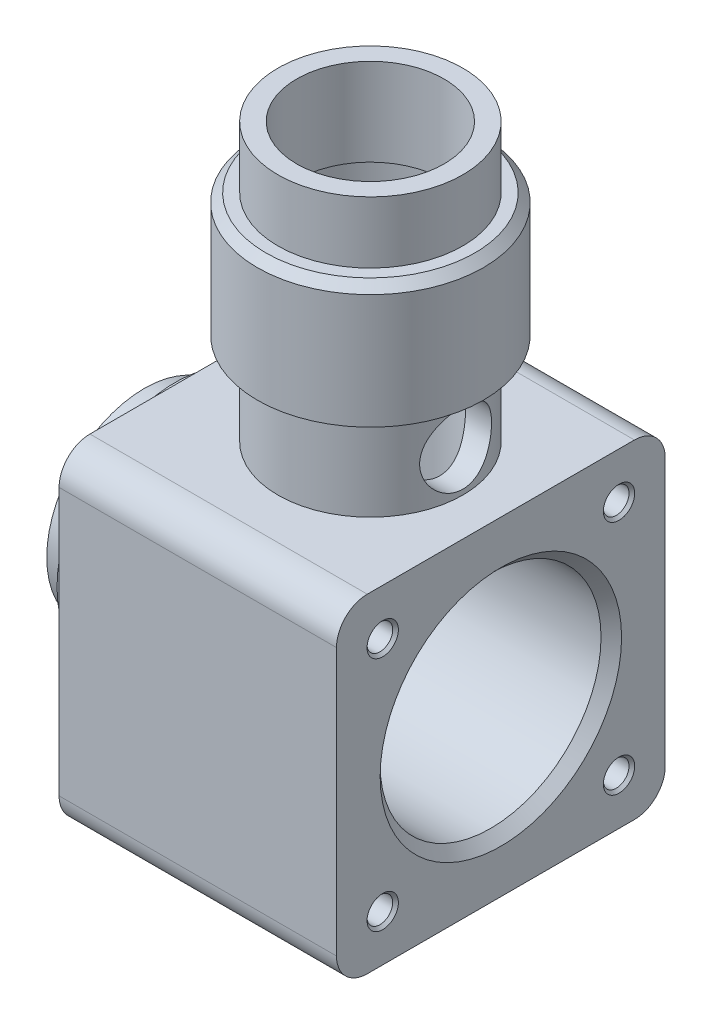
from build123d import *

# Parameters (mm, degrees)
SKETCH_2_R               = 9
EXTRUDE_1_DEPTH          = 25
SKETCH_3_R               = 11
EXTRUDE_2_DEPTH          = 12
SKETCH_4_R               = 9
EXTRUDE_3_DEPTH          = 6
SKETCH_5_R               = 10.75
CUT_EXTRUDE_1_DEPTH      = 23.1
CUT_EXTRUDE_START        = -8.5
SKETCH_6_R               = 8.5
CUT_EXTRUDE_2_DEPTH      = 7
CUT_EXTRUDE_3_REACH      = 59.899
CUT_EXTRUDE_3_END_RADIUS = 10.75
SKETCH_8_R               = 6.75
SKETCH_9_R               = 3.5
CUT_EXTRUDE_4_DEPTH      = 58.524690439
SKETCH_10_R              = 10.75
EXTRUDE_4_DEPTH          = 5.95
CHAMFER_1_SIZE           = 0.828
SKETCH_12_W              = 32
SKETCH_12_H              = 32
SKETCH_12_R              = 15
EXTRUDE_5_DEPTH          = 27
CUT_EXTRUDE_5_REACH      = 51.841
SKETCH_13_R              = 6.75
CUT_EXTRUDE_6_REACH      = 72.293
SKETCH_14_R              = 7.172
CUT_EXTRUDE_11_REACH     = 56.144
SKETCH_18_R              = 10.75
M3X0_51_D                = 2.5
M3X0_51_DEPTH            = 8.5
M3X0_51_CSINK_D          = 3.05
M3X0_51_CSINK_ANGLE      = 90
M3X0_51_TIP              = 0.751075774
FILLET_1_R               = 3
CHAMFER_2_SIZE           = 1


with BuildPart() as part:
    # Эскиз1 → Повернуть1 (revolve)
    with BuildSketch(Plane.XY, mode=Mode.PRIVATE) as revolve_1_sk:
        Polygon((0, -7), (11.6, -7), (11.6, 0), (34.7, 0), (34.7, -10.5), (34.7, -16), (7.7, -16), (7.7, -9.5), (4.2, -9.5), (4.2, -11.5), (3, -11.5), (3, -9.5), (0, -9.5), align=None)
    revolve(revolve_1_sk.sketch.rotate(Axis((0, 0, 0), (1, 0, 0)), 270), axis=Axis((0, 0, 0), (1, 0, 0)))

    # Эскиз2 → Бобышка-Вытянуть1 (add)
    with BuildSketch(Plane(origin=(0, 0, 0), x_dir=(1, 0, 0), z_dir=(0, 1, 0))):
        with Locations(Location((22, 0, 0), (0, 0, 90))):
            Circle(SKETCH_2_R)
    extrude(amount=EXTRUDE_1_DEPTH)

    # Эскиз3 → Бобышка-Вытянуть2 (add)
    with BuildSketch(Plane(origin=(0, 25, 0), x_dir=(1, 0, 0), z_dir=(0, 1, 0))):
        with Locations(Location((22, 0, 0), (0, 0, 270))):
            Circle(SKETCH_3_R)
    extrude(amount=EXTRUDE_2_DEPTH)

    # Эскиз4 → Бобышка-Вытянуть3 (add)
    with BuildSketch(Plane(origin=(0, 37, 0), x_dir=(1, 0, 0), z_dir=(0, 1, 0))):
        with Locations(Location((22, 0, 0), (0, 0, 90))):
            Circle(SKETCH_4_R)
    extrude(amount=EXTRUDE_3_DEPTH)

    # Эскиз5 → Вырез-Вытянуть1 (cut)
    with BuildSketch(Plane(origin=(34.7, 0, 0), x_dir=(0, 0, -1), z_dir=(1, 0, 0))):
        Circle(SKETCH_5_R)
    extrude(amount=-CUT_EXTRUDE_1_DEPTH, mode=Mode.SUBTRACT)

    # Эскиз6 → Вырез-Вытянуть2 (cut)
    with BuildSketch(Plane(origin=(0, 43, 0), x_dir=(1, 0, 0), z_dir=(0, 1, 0)).offset(CUT_EXTRUDE_START)):
        with Locations(Location((22, 0, 0), (0, 0, 270))):
            Circle(SKETCH_6_R)
    extrude(amount=-CUT_EXTRUDE_2_DEPTH, mode=Mode.SUBTRACT)

    # Вырез-Вытянуть3: up to this cylinder (the profile starts outside it)
    cut_extrude_3_end = Plane(origin=(22, 0, 0), z_dir=(1, 0, 0)) * Cylinder(CUT_EXTRUDE_3_END_RADIUS, 142.298, mode=Mode.PRIVATE)
    # Эскиз8 → Вырез-Вытянуть3 (cut, up to the surface)
    with BuildSketch(Plane(origin=(0, 27.5, 0), x_dir=(1, 0, 0), z_dir=(0, 1, 0)), mode=Mode.PRIVATE) as cut_extrude_3_sk1:
        with Locations(Location((22, 0, 0), (0, 0, 270))):
            Circle(SKETCH_8_R)
    cut_extrude_3_tool1 = extrude(cut_extrude_3_sk1.sketch, amount=-CUT_EXTRUDE_3_REACH, mode=Mode.PRIVATE) - cut_extrude_3_end
    add(cut_extrude_3_tool1.solids().sort_by_distance((22, 27.5, 0))[0], mode=Mode.SUBTRACT)

    # Эскиз9 → Вырез-Вытянуть4 (cut, through all)
    with BuildSketch(Plane(origin=(0, 0, 0), x_dir=(0, 0, -1), z_dir=(1, 0, 0))):
        with Locations(Location((0, 20, 0), (0, 0, 180))):
            Circle(SKETCH_9_R)
    extrude(amount=CUT_EXTRUDE_4_DEPTH, mode=Mode.SUBTRACT)

    # Эскиз10 → Бобышка-Вытянуть4 (add)
    with BuildSketch(Plane(origin=(34.7, 0, 0), x_dir=(0, 0, -1), z_dir=(1, 0, 0))):
        with Locations(Location((0, 0, 0), (0, 0, 90))):
            Circle(SKETCH_10_R)
    extrude(amount=-EXTRUDE_4_DEPTH)

    # Фаска1
    chamfer_1_edges = [part.edges().sort_by_distance(p)[0] for p in [
        (22, 37, -11),
    ]]
    chamfer(chamfer_1_edges, length=CHAMFER_1_SIZE)

    # Эскиз12 → Бобышка-Вытянуть5 (add)
    with BuildSketch(Plane(origin=(34.7, 0, 0), x_dir=(0, 0, -1), z_dir=(1, 0, 0))):
        Rectangle(SKETCH_12_W, SKETCH_12_H)
        Circle(SKETCH_12_R, mode=Mode.SUBTRACT)
    extrude(amount=-EXTRUDE_5_DEPTH)

    # Эскиз13 → Вырез-Вытянуть5 (cut, up to next)
    with BuildSketch(Plane(origin=(0, 16, 0), x_dir=(1, 0, 0), z_dir=(0, 1, 0)), mode=Mode.PRIVATE) as cut_extrude_5_sk1:
        with Locations(Location((22, 0, 0), (0, 0, 270))):
            Circle(SKETCH_13_R)
    cut_extrude_5_tool1 = extrude(cut_extrude_5_sk1.sketch, amount=-CUT_EXTRUDE_5_REACH, mode=Mode.PRIVATE) & part.part
    add(cut_extrude_5_tool1.solids().sort_by_distance((22, 16, 0))[0], mode=Mode.SUBTRACT)

    # Эскиз14 → Вырез-Вытянуть6 (cut, up to next)
    with BuildSketch(Plane(origin=(0, 43, 0), x_dir=(1, 0, 0), z_dir=(0, 1, 0)), mode=Mode.PRIVATE) as cut_extrude_6_sk1:
        with Locations(Location((22, 0, 0), (0, 0, 270))):
            Circle(SKETCH_14_R)
    cut_extrude_6_tool1 = extrude(cut_extrude_6_sk1.sketch, amount=-CUT_EXTRUDE_6_REACH, mode=Mode.PRIVATE) & part.part
    add(cut_extrude_6_tool1.solids().sort_by_distance((22, 43, 0))[0], mode=Mode.SUBTRACT)

    # Эскиз18 → Вырез-Вытянуть11 (cut, up to next)
    with BuildSketch(Plane.ZY.offset(-28.75), mode=Mode.PRIVATE) as cut_extrude_11_sk1:
        with Locations(Location((0, 0, 0), (0, 0, 180))):
            Circle(SKETCH_18_R)
    cut_extrude_11_tool1 = extrude(cut_extrude_11_sk1.sketch, amount=-CUT_EXTRUDE_11_REACH, mode=Mode.PRIVATE) & part.part
    add(cut_extrude_11_tool1.solids().sort_by_distance((28.75, 0, 0))[0], mode=Mode.SUBTRACT)

    # Отверстие обработанное метчиком M3x0.51
    with Locations(Plane(origin=(34.7, 11.5, 11.5), x_dir=(0, 0, 1), z_dir=(1, 0, 0))):
        with Locations((0, 0), (0, 23), (-23, 23), (-23, 0)):
            CounterSinkHole(M3X0_51_D / 2, M3X0_51_CSINK_D / 2, depth=M3X0_51_DEPTH, counter_sink_angle=M3X0_51_CSINK_ANGLE)
            with Locations((0, 0, -(M3X0_51_DEPTH + M3X0_51_TIP / 2))):  # 118° drill point
                Cone(0, M3X0_51_D / 2, M3X0_51_TIP, mode=Mode.SUBTRACT)

    # Скругление1
    fillet_1_edges = [part.edges().sort_by_distance(p)[0] for p in [
        (21.2, 16, -16),
        (21.2, -16, -16),
        (21.2, -16, 16),
        (21.2, 16, 16),
    ]]
    fillet(fillet_1_edges, radius=FILLET_1_R)

    # Фаска2
    chamfer_2_edges = [part.edges().sort_by_distance(p)[0] for p in [
        (34.7, 0, 10.75),
    ]]
    chamfer(chamfer_2_edges, length=CHAMFER_2_SIZE)


solid = part.part
